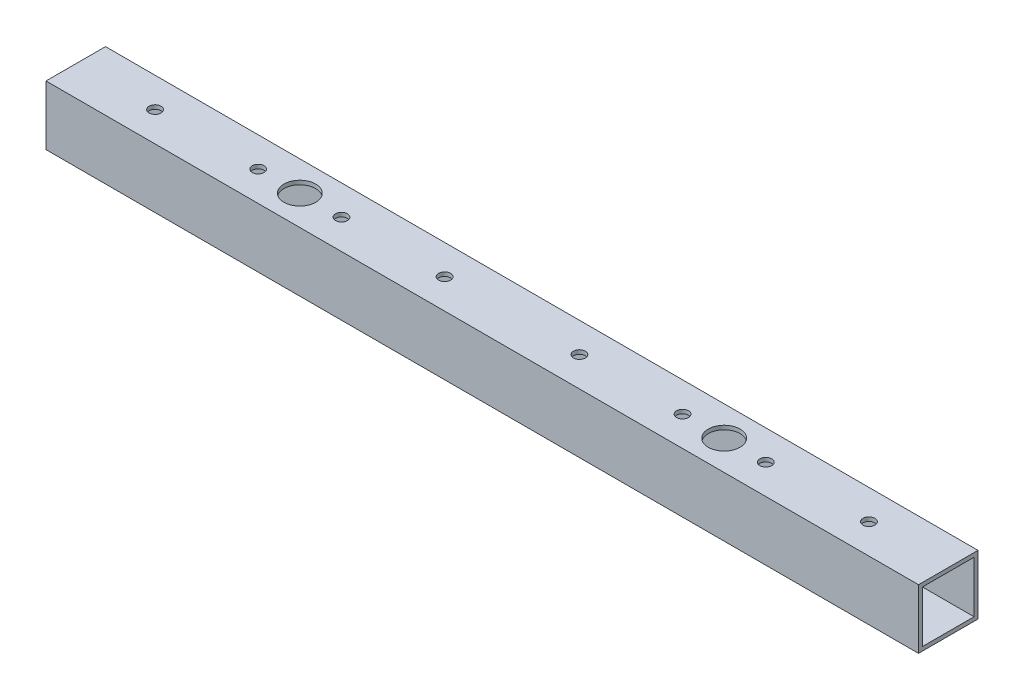
from build123d import *

# Parameters (mm, degrees)
SKETCH_1_W          = 15
SKETCH_1_H          = 15
SKETCH_1_W_2        = 13
SKETCH_1_H_2        = 13
EXTRUDE_1_DEPTH     = 220
SKETCH_2_R          = 1.5
CUT_EXTRUDE_1_DEPTH = 230
SKETCH_3_R          = 4
CUT_EXTRUDE_2_DEPTH = 3
SKETCH_4_R          = 4
CUT_EXTRUDE_3_DEPTH = 3


with BuildPart() as part:
    # 草图1 → 凸台-拉伸1 (new body)
    with BuildSketch(Plane(origin=(0, 0, 0), x_dir=(0, 0, -1), z_dir=(1, 0, 0))):
        Rectangle(SKETCH_1_W, SKETCH_1_H)
        Rectangle(SKETCH_1_W_2, SKETCH_1_H_2, mode=Mode.SUBTRACT)
    extrude(amount=EXTRUDE_1_DEPTH)

    # 草图2 → 切除-拉伸1 (cut)
    with BuildSketch(Plane(origin=(0, 7.5, 0), x_dir=(1, 0, 0), z_dir=(0, 1, 0))):
        with Locations(Location((20, 0, 0), (0, 0, 270))):
            Circle(SKETCH_2_R)
        with Locations(Location((46, 0, 0), (0, 0, 270))):
            Circle(SKETCH_2_R)
        with Locations(Location((56.5, 0, 0), (0, 0, 270))):
            Circle(SKETCH_2_R)
        with Locations(Location((67, 0, 0), (0, 0, 270))):
            Circle(SKETCH_2_R)
        with Locations(Location((93, 0, 0), (0, 0, 270))):
            Circle(SKETCH_2_R)
        with Locations(Location((127, 0, 0), (0, 0, 90))):
            Circle(SKETCH_2_R)
        with Locations(Location((153, 0, 0), (0, 0, 90))):
            Circle(SKETCH_2_R)
        with Locations(Location((163.5, 0, 0), (0, 0, 90))):
            Circle(SKETCH_2_R)
        with Locations(Location((174, 0, 0), (0, 0, 90))):
            Circle(SKETCH_2_R)
        with Locations(Location((200, 0, 0), (0, 0, 90))):
            Circle(SKETCH_2_R)
    extrude(amount=-CUT_EXTRUDE_1_DEPTH, mode=Mode.SUBTRACT)

    # 草图3 → 切除-拉伸2 (cut)
    with BuildSketch(Plane(origin=(0, 7.5, 0), x_dir=(1, 0, 0), z_dir=(0, 1, 0))):
        with Locations(Location((56.5, 0, 0), (0, 0, 270))):
            Circle(SKETCH_3_R)
        with Locations(Location((163.5, 0, 0), (0, 0, 270))):
            Circle(SKETCH_3_R)
    extrude(amount=-CUT_EXTRUDE_2_DEPTH, mode=Mode.SUBTRACT)

    # 草图4 → 切除-拉伸3 (cut)
    with BuildSketch(Plane.XZ.offset(7.5)):
        with Locations(Location((20, 0, 0), (0, 0, 270))):
            Circle(SKETCH_4_R)
        with Locations(Location((46, 0, 0), (0, 0, 270))):
            Circle(SKETCH_4_R)
        with Locations(Location((67, 0, 0), (0, 0, 270))):
            Circle(SKETCH_4_R)
        with Locations(Location((93, 0, 0), (0, 0, 270))):
            Circle(SKETCH_4_R)
        with Locations(Location((127, 0, 0), (0, 0, 270))):
            Circle(SKETCH_4_R)
        with Locations(Location((153, 0, 0), (0, 0, 270))):
            Circle(SKETCH_4_R)
        with Locations(Location((174, 0, 0), (0, 0, 270))):
            Circle(SKETCH_4_R)
        with Locations(Location((200, 0, 0), (0, 0, 270))):
            Circle(SKETCH_4_R)
    extrude(amount=-CUT_EXTRUDE_3_DEPTH, mode=Mode.SUBTRACT)


solid = part.part
